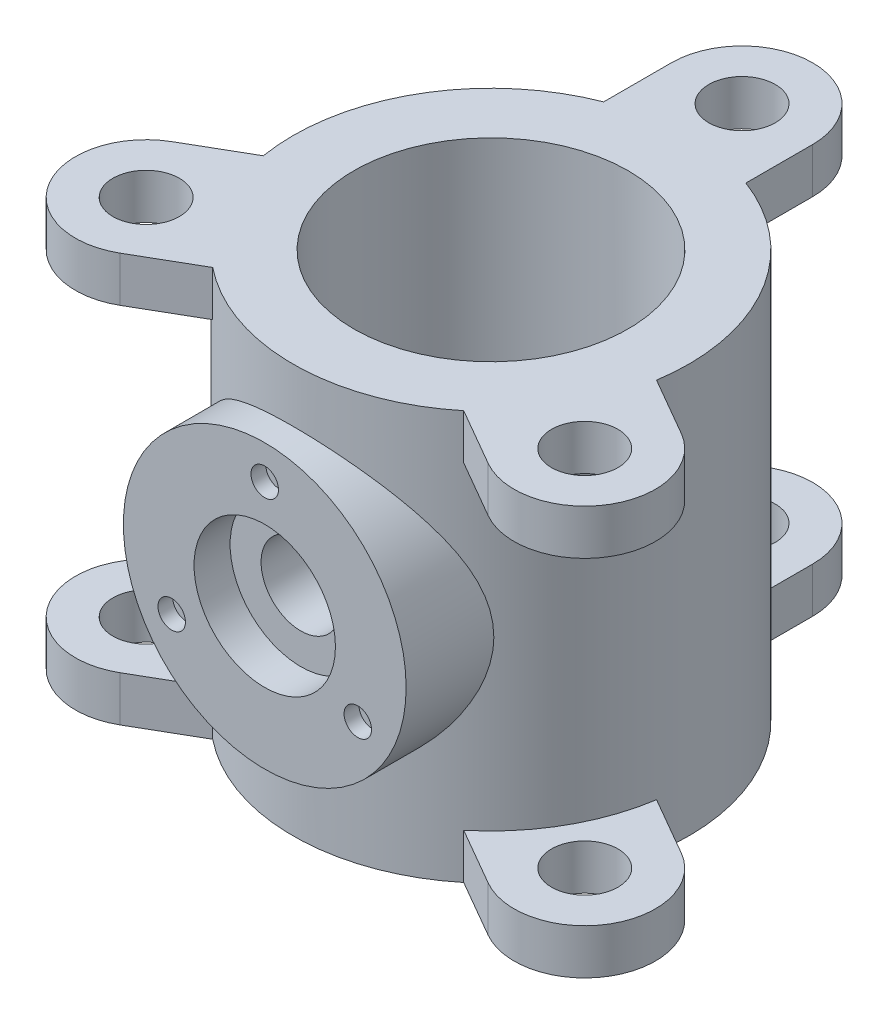
from build123d import *

# Parameters (mm, degrees)
SKETCH2_R                 = 23.5
SKETCH2_R_2               = 97
BOSS_EXTRUDE5_DEPTH       = 32
SKETCH3_R                 = 140
SKETCH3_R_2               = 97
BOSS_EXTRUDE8_DEPTH       = 112.5
BOSS_EXTRUDE10_REACH      = 527.627
BOSS_EXTRUDE10_END_RADIUS = 140
SKETCH4_R                 = 100
SKETCH5_R                 = 50
CUT_EXTRUDE1_DEPTH        = 25.5
SKETCH7_R                 = 28.1
CUT_EXTRUDE2_DEPTH        = 328.5
SKETCH9_R                 = 9.714368659
CUT_EXTRUDE3_DEPTH        = 10.5


with BuildPart() as part:
    # Sketch2 → Boss-Extrude5 (new body)
    with BuildSketch(Plane(origin=(0, 0, 0), x_dir=(1, 0, 0), z_dir=(0, 1, 0))):
        with BuildLine():
            ThreePointArc((49.230976904, 178.339293487), (-0.769023096, 228.339293487), (-50.769023096, 178.339293487))
            Line((-50.769023096, 178.339293487), (-50.769023096, 130.470327254))
            ThreePointArc((-50.769023096, 130.470327254), (-121.653121624, 69.285770538), (-138.115414376, -22.893936133))
            Line((-138.115414376, -22.893936133), (-179.061847104, -46.534370091))
            ThreePointArc((-179.061847104, -46.534370091), (-197.363117294, -114.835640281), (-129.061847104, -133.13691047))
            Line((-129.061847104, -133.13691047), (-87.606106294, -109.202427354))
            ThreePointArc((-87.606106294, -109.202427354), (0.823323405, -139.997579045), (88.884437472, -108.164489437))
            Line((88.884437472, -108.164489437), (129.8308702, -131.804923395))
            ThreePointArc((129.8308702, -131.804923395), (198.13214039, -113.503653206), (179.8308702, -45.202383017))
            Line((179.8308702, -45.202383017), (138.37512939, -21.267899901))
            ThreePointArc((138.37512939, -21.267899901), (120.829798219, 70.711808507), (49.230976904, 131.058425571))
            Line((49.230976904, 131.058425571), (49.230976904, 178.339293487))
        make_face()
        with Locations(Location((-0.769023096, 178.339293487, 0), (0, 0, 270))):
            Circle(SKETCH2_R, mode=Mode.SUBTRACT)
        with Locations(Location((0, 0, 0), (0, 0, 270))):
            Circle(SKETCH2_R_2, mode=Mode.SUBTRACT)
        with Locations(Location((-154.061847104, -89.835640281, 0), (0, 0, 270))):
            Circle(SKETCH2_R, mode=Mode.SUBTRACT)
        with Locations(Location((154.8308702, -88.503653206, 0), (0, 0, 270))):
            Circle(SKETCH2_R, mode=Mode.SUBTRACT)
    extrude(amount=BOSS_EXTRUDE5_DEPTH)

    # Sketch3 → Boss-Extrude8 (add)
    with BuildSketch(Plane(origin=(0, 32, 0), x_dir=(1, 0, 0), z_dir=(0, 1, 0))):
        with Locations(Location((0, 0, 0), (0, 0, 69.411740358))):
            Circle(SKETCH3_R)
        with Locations(Location((0, 0, 0), (0, 0, 270))):
            Circle(SKETCH3_R_2, mode=Mode.SUBTRACT)
    extrude(amount=BOSS_EXTRUDE8_DEPTH)

    # Mirror1: part across plane


with BuildPart() as part_1:
    add(part.part)
    add(part.part.mirror(Plane.ZX.offset(144.5)))

    # Boss-Extrude10: up to this cylinder (the profile starts outside it)
    boss_extrude10_end = Plane(origin=(0, 150.900402, 0), z_dir=(0, -1, 0)) * Cylinder(BOSS_EXTRUDE10_END_RADIUS, 1336.254, mode=Mode.PRIVATE)
    # Sketch4 → Boss-Extrude10 (add, up to the surface)
    with BuildSketch(Plane.XY.offset(160), mode=Mode.PRIVATE) as boss_extrude10_sk1:
        with Locations((0, 150.900402454)):
            Circle(SKETCH4_R)
    boss_extrude10_tool1 = extrude(boss_extrude10_sk1.sketch, amount=-BOSS_EXTRUDE10_REACH, mode=Mode.PRIVATE) - boss_extrude10_end
    add(boss_extrude10_tool1.solids().sort_by_distance((0, 150.900402, 160))[0])

    # Sketch5 → Cut-Extrude1 (cut)
    with BuildSketch(Plane.XY.offset(160)):
        with Locations((0, 150.900402454)):
            Circle(SKETCH5_R)
    extrude(amount=-CUT_EXTRUDE1_DEPTH, mode=Mode.SUBTRACT)

    # Sketch7 → Cut-Extrude2 (cut)
    with BuildSketch(Plane.XY.offset(134.5)):
        with Locations(Location((0, 150.900402454, 0), (0, 0, 90))):
            Circle(SKETCH7_R)
    extrude(amount=-CUT_EXTRUDE2_DEPTH, mode=Mode.SUBTRACT)

    # Sketch9 → Cut-Extrude3 (cut)
    with BuildSketch(Plane.XY.offset(160)):
        with Locations((0, 226.895659714)):
            Circle(SKETCH9_R)
        with Locations((65.813823354, 112.902773824)):
            Circle(SKETCH9_R)
        with Locations((-65.813823354, 112.902773824)):
            Circle(SKETCH9_R)
    extrude(amount=-CUT_EXTRUDE3_DEPTH, mode=Mode.SUBTRACT)


solid = part_1.part
